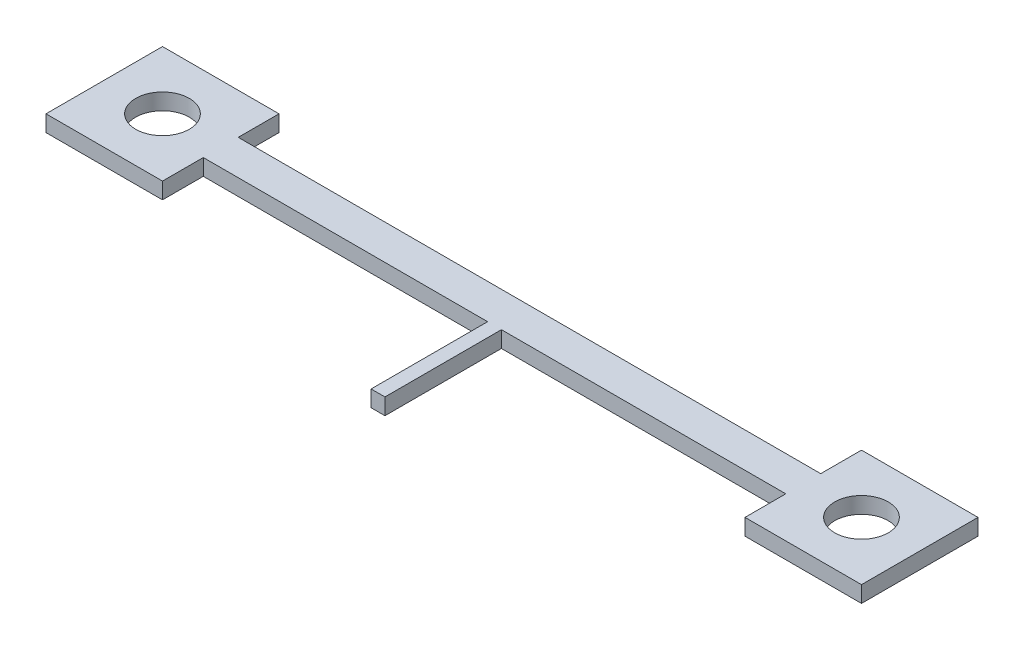
from build123d import *

# Parameters (mm, degrees)
BOSS_EXTRUDE1_DEPTH          = 0.4445
F_97_0_0059_DIAMETER_HOLE1_D = 2.921
SKETCH7_W                    = 0.500000016
SKETCH7_H                    = 0.889
BOSS_EXTRUDE2_DEPTH          = 6.35
SKETCH11_W                   = 6.35
SKETCH11_H                   = 0.889
BOSS_EXTRUDE3_DEPTH          = 0.127
SKETCH12_W                   = 6.35
SKETCH12_H                   = 0.889
BOSS_EXTRUDE4_DEPTH          = 0.127


with BuildPart() as part:
    # Sketch1 → Boss-Extrude1 (new, symmetric)
    with BuildSketch(Plane(origin=(0, 0, 0), x_dir=(1, 0, 0), z_dir=(0, 1, 0))):
        Polygon((-41.424046485, -10.283259465), (-41.424046485, -12.505759465), (-47.774046485, -12.505759465), (-47.774046485, -6.155759465), (-41.424046485, -6.155759465), (-41.424046485, -8.378259465), (-9.674046485, -8.378259465), (-9.674046485, -6.155759465), (-3.324046485, -6.155759465), (-3.324046485, -12.505759465), (-9.674046485, -12.505759465), (-9.674046485, -10.283259465), align=None)
    extrude(amount=BOSS_EXTRUDE1_DEPTH, both=True)

    # #97 (0.0059) Diameter Hole1 (through all)
    with Locations(Plane(origin=(0, 0.4445, 0), x_dir=(-1, 0, 0), z_dir=(0, 1, 0))):
        with Locations((44.599046485, 9.330759465)):
            f_97_0_0059_diameter_hole1 = Hole(F_97_0_0059_DIAMETER_HOLE1_D / 2)

    # Mirror1: #97 (0.0059) Diameter Hole1 across plane
    add(f_97_0_0059_diameter_hole1.mirror(Plane(origin=(-25.549046485, 0, 0), x_dir=(0, 0, 1), z_dir=(1, 0, 0))), mode=Mode.SUBTRACT)

    # Sketch7 → Boss-Extrude2 (add)
    with BuildSketch(Plane.XY.offset(10.283259465)):
        with Locations((-25.549046485, 0)):
            Rectangle(SKETCH7_W, SKETCH7_H)
    extrude(amount=BOSS_EXTRUDE2_DEPTH)

    # Sketch11 → Boss-Extrude3 (add)
    with BuildSketch(Plane.ZY.offset(25.799046493)):
        with Locations((13.458259465, 0)):
            Rectangle(SKETCH11_W, SKETCH11_H)
    extrude(amount=BOSS_EXTRUDE3_DEPTH)

    # Sketch12 → Boss-Extrude4 (add)
    with BuildSketch(Plane(origin=(-25.299046477, 0, 0), x_dir=(0, 0, -1), z_dir=(1, 0, 0))):
        with Locations((-13.458259465, 0)):
            Rectangle(SKETCH12_W, SKETCH12_H)
    extrude(amount=BOSS_EXTRUDE4_DEPTH)


solid = part.part
